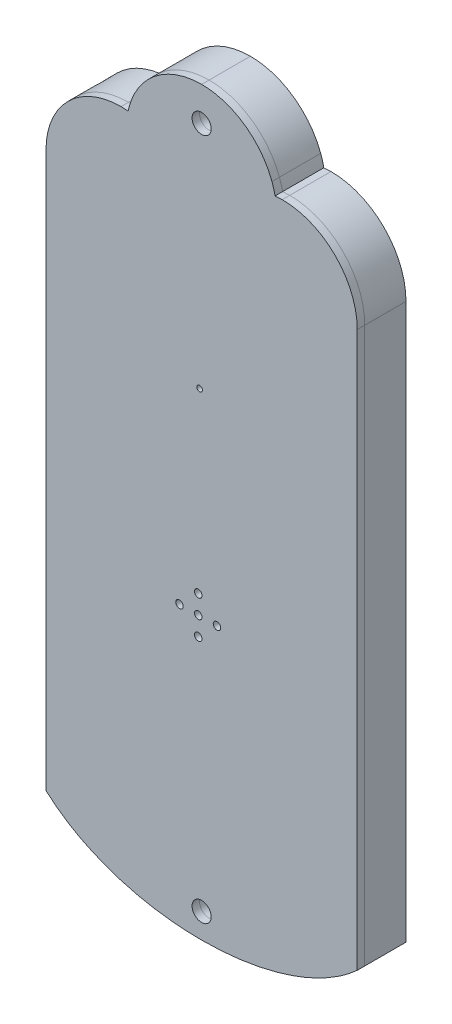
from build123d import *

# Parameters (mm, degrees)
SKETCH_1_R          = 2.55
EXTRUDE_1_DEPTH     = 11
CUT_EXTRUDE_1_DEPTH = 12
SKETCH_3_W          = 3.57346696
SKETCH_3_H          = 6.992054996
EXTRUDE_2_DEPTH     = 9
EXTRUDE_2_2_DEPTH   = 9
SKETCH_3_H_2        = 8.312138205
EXTRUDE_2_3_DEPTH   = 9
SKETCH_3_H_3        = 12.586021109
EXTRUDE_2_4_DEPTH   = 9
EXTRUDE_2_5_DEPTH   = 9
EXTRUDE_2_6_DEPTH   = 9
SKETCH_3_3_W        = 3.57346696
SKETCH_3_3_H        = 19.695806799
SKETCH_3_3_H_2      = 31.259766677
SKETCH_3_3_H_3      = 29.757407966
SKETCH_3_3_H_4      = 25.595250748
SKETCH_3_3_H_5      = 20
EXTRUDE_3_DEPTH     = 2
EXTRUDE_4_DEPTH     = 2
EXTRUDE_4_2_DEPTH   = 2
SKETCH_3_5_R        = 22
SKETCH_3_5_R_2      = 20
EXTRUDE_5_DEPTH     = 5
SKETCH_3_6_W        = 3.57346696
SKETCH_3_6_H        = 18.699822207
EXTRUDE_6_DEPTH     = 8.5
SKETCH_3_6_H_2      = 18.12494327
EXTRUDE_6_2_DEPTH   = 8.5
SKETCH_3_6_H_3      = 9.445483778
EXTRUDE_6_3_DEPTH   = 8.5
SKETCH_3_6_H_4      = 6.980918364
EXTRUDE_6_4_DEPTH   = 8.5
SKETCH_3_6_H_5      = 7.401231098
EXTRUDE_6_5_DEPTH   = 8.5
SKETCH_3_7_W        = 3.57346696
SKETCH_3_7_H        = 19.029379681
EXTRUDE_7_DEPTH     = 2
SKETCH_3_7_H_2      = 19.142987079
EXTRUDE_7_2_DEPTH   = 2
SKETCH_3_7_H_3      = 25.175234523
EXTRUDE_7_3_DEPTH   = 2
SKETCH_5_R          = 2.55
SKETCH_5_R_2        = 0.75
SKETCH_5_R_3        = 1
EXTRUDE_8_DEPTH     = 2
SKETCH_5_4_W        = 8.848247072
SKETCH_5_4_H        = 2.143421059
EXTRUDE_9_DEPTH     = 9
EXTRUDE_9_2_DEPTH   = 9
SKETCH_5_4_W_2      = 1.816180615
SKETCH_5_4_H_2      = 5.029639524
EXTRUDE_9_3_DEPTH   = 9
SKETCH_5_5_W        = 8.848247072
SKETCH_5_5_H        = 2.382179266
EXTRUDE_10_DEPTH    = 7
SKETCH_5_5_W_2      = 4.568018048
SKETCH_5_5_H_2      = 3
EXTRUDE_10_2_DEPTH  = 7
SKETCH_5_6_W        = 2.735670627
SKETCH_5_6_H        = 5.029639524
EXTRUDE_11_DEPTH    = 6


with BuildPart() as part:
    # 草图1 → 凸台-拉伸1 (new body)
    with BuildSketch(Plane.XY):
        with BuildLine():
            Line((-41.500782935, 68.140791219), (-41.500782935, -79.859208781))
            add(Edge.make_bspline(
                [(-41.500782935, -79.859208781), (-38.389280352, -82.702596808), (-34.568690991, -85.207331949), (-30.197769157, -87.278135781)],
                knots=[11, 11, 11, 11, 12, 12, 12, 12], degree=3))
            add(Edge.make_bspline(
                [(-30.197769157, -87.278135781), (-21.780496549, -91.268051585), (-11.324158051, -93.62813578), (0, -93.62813578)],
                knots=[12, 12, 12, 12, 13, 13, 13, 13], degree=3))
            add(Edge.make_bspline(
                [(0, -93.62813578), (11.324158051, -93.62813578), (21.780496549, -91.268051585), (30.197769157, -87.278135781)],
                knots=[13, 13, 13, 13, 14, 14, 14, 14], degree=3))
            add(Edge.make_bspline(
                [(30.197769157, -87.278135781), (34.568690991, -85.207331949), (38.389280352, -82.702596808), (41.500782935, -79.859208781)],
                knots=[14, 14, 14, 14, 15, 15, 15, 15], degree=3))
            Line((41.500782935, -79.859208781), (41.500782935, 68.140791219))
            add(Edge.make_bspline(
                [(41.500782935, 68.140791219), (41.500782935, 79.186262577), (32.547281215, 88.139764297), (21.501809857, 88.139764297)],
                knots=[0, 0, 0, 0, 1, 1, 1, 1], degree=3))
            add(Edge.make_bspline(
                [(21.501809857, 88.139764297), (20.859751717, 88.139764297), (20.221224801, 88.108026355), (19.593270021, 88.04803863)],
                knots=[1, 1, 1, 1, 2, 2, 2, 2], degree=3))
            add(Edge.make_bspline(
                [(19.593270021, 88.04803863), (19.388674413, 89.04640577), (19.106434966, 90.020075881), (18.760719634, 90.961986519)],
                knots=[2, 2, 2, 2, 3, 3, 3, 3], degree=3))
            add(Edge.make_bspline(
                [(18.760719634, 90.961986519), (15.938497412, 98.581999436), (8.604255165, 104.014764294), (0, 104.014764294)],
                knots=[3, 3, 3, 3, 4, 4, 4, 4], degree=3))
            add(Edge.make_bspline(
                [(0, 104.014764294), (-8.604255165, 104.014764294), (-15.938497412, 98.581999436), (-18.760719634, 90.961986519)],
                knots=[4, 4, 4, 4, 5, 5, 5, 5], degree=3))
            add(Edge.make_bspline(
                [(-18.760719634, 90.961986519), (-19.106456498, 90.020075881), (-19.388674413, 89.04640577), (-19.593270021, 88.04803863)],
                knots=[5, 5, 5, 5, 6, 6, 6, 6], degree=3))
            add(Edge.make_bspline(
                [(-19.593270021, 88.04803863), (-20.221224801, 88.108026355), (-20.856220494, 88.139764297), (-21.498278634, 88.139764297)],
                knots=[6, 6, 6, 6, 7, 7, 7, 7], degree=3))
            add(Edge.make_bspline(
                [(-21.498278634, 88.139764297), (-32.547281215, 88.139764297), (-41.500782935, 79.186262577), (-41.500782935, 68.140791219)],
                knots=[7, 7, 7, 7, 8, 8, 8, 8], degree=3))
        make_face()
        with Locations((0, 95)):
            Circle(SKETCH_1_R, mode=Mode.SUBTRACT)
        with Locations((0, -87)):
            Circle(SKETCH_1_R, mode=Mode.SUBTRACT)
    extrude(amount=EXTRUDE_1_DEPTH)

    # 草图2 → 切除-拉伸1 (cut)
    with BuildSketch(Plane.XY.offset(11)):
        with BuildLine():
            Line((-39, 72.56175603), (-31.85306608, 72.56175603))
            add(Edge.make_bspline(
                [(31.85306608, 72.56175603), (31.85306608, 88.82119273), (0, 88.82119273), (-31.85306608, 88.82119273), (-31.85306608, 72.56175603)],
                knots=[0, 0, 0, 1.570796327, 1.570796327, 3.141592654, 3.141592654, 3.141592654], degree=2, weights=[1, 0.707106781, 1, 0.707106781, 1]))
            Line((31.85306608, 72.56175603), (39, 72.56175603))
            Line((39, 72.56175603), (39, -79.43824397))
            Line((39, -79.43824397), (33.590068299, -79.43824397))
            ThreePointArc((33.590068299, -79.43824397), (33.058093845, -79.485786827), (32.542980448, -79.626908516))
            Line((32.542980448, -79.626908516), (5.947078237, -89.532608684))
            Line((5.947078237, -89.532608684), (5.947078237, -84.669920089))
            ThreePointArc((5.947078237, -84.669920089), (5.06839858, -82.548599745), (2.947078237, -81.669920089))
            Line((2.947078237, -81.669920089), (-3.919139465, -81.669920089))
            ThreePointArc((-3.919139465, -81.669920089), (-6.040459809, -82.548599745), (-6.919139465, -84.669920089))
            Line((-6.919139465, -84.669920089), (-6.919139465, -88.936950457))
            Line((-6.919139465, -88.936950457), (-32.753744515, -79.616285846))
            ThreePointArc((-32.753744515, -79.616285846), (-33.255075458, -79.483089628), (-33.771856663, -79.43824397))
            Line((-33.771856663, -79.43824397), (-39, -79.43824397))
            Line((-39, -79.43824397), (-39, 72.56175603))
        make_face()
    extrude(amount=-CUT_EXTRUDE_1_DEPTH, mode=Mode.SUBTRACT)


with BuildPart() as body_2:
    # 草图3 → 凸台-拉伸2 (new body)
    with BuildSketch(Plane.XY.offset(11)):
        with Locations((37.21326652, 69.065728532)):
            Rectangle(SKETCH_3_W, SKETCH_3_H)
    extrude(amount=-EXTRUDE_2_DEPTH)


with BuildPart() as body_3:
    # 草图3 → Extrude 2 2 (new body)
    with BuildSketch(Plane.XY.offset(11)):
        with Locations((-37.21326652, 69.065728532)):
            Rectangle(SKETCH_3_W, SKETCH_3_H)
    extrude(amount=-EXTRUDE_2_2_DEPTH)


with BuildPart() as body_4:
    # 草图3 → Extrude 2 3 (new body)
    with BuildSketch(Plane.XY.offset(11)):
        with Locations((-37.21326652, 41.717825133)):
            Rectangle(SKETCH_3_W, SKETCH_3_H_2)
    extrude(amount=-EXTRUDE_2_3_DEPTH)


with BuildPart() as body_5:
    # 草图3 → Extrude 2 4 (new body)
    with BuildSketch(Plane.XY.offset(11)):
        with Locations((37.21326652, 28.016923803)):
            Rectangle(SKETCH_3_W, SKETCH_3_H_3)
    extrude(amount=-EXTRUDE_2_4_DEPTH)


with BuildPart() as body_6:
    # 草图3 → Extrude 2 5 (new body)
    with BuildSketch(Plane.XY.offset(11)):
        Polygon((35.42653304, -14.104654672), (35.42653304, -17.43824397), (39, -17.43824397), (39, -8.033494718), (35.42653304, -8.033494718), align=None)
    extrude(amount=-EXTRUDE_2_5_DEPTH)


with BuildPart() as body_7:
    # 草图3 → Extrude 2 6 (new body)
    with BuildSketch(Plane.XY.offset(11)):
        Polygon((-35.42653304, -17.43824397), (-35.42653304, -14.104654672), (-35.42653304, -8.033494718), (-39, -8.033494718), (-39, -17.43824397), align=None)
    extrude(amount=-EXTRUDE_2_6_DEPTH)


with BuildPart() as body_8:
    # 草图3<3> → 凸台-拉伸3 (new body)
    with BuildSketch(Plane.XY.offset(11)):
        with Locations((-37.21326652, 55.721797635)):
            Rectangle(SKETCH_3_3_W, SKETCH_3_3_H)
        with Locations((37.21326652, 49.939817696)):
            Rectangle(SKETCH_3_3_W, SKETCH_3_3_H_2)
        with Locations((37.21326652, 6.845209265)):
            Rectangle(SKETCH_3_3_W, SKETCH_3_3_H_3)
        with Locations((-37.21326652, 4.764130656)):
            Rectangle(SKETCH_3_3_W, SKETCH_3_3_H_4)
        with Locations((-37.21326652, 27.56175603)):
            Rectangle(SKETCH_3_3_W, SKETCH_3_3_H_5)
    extrude(amount=-EXTRUDE_3_DEPTH)


with BuildPart() as body_9:
    # 草图3<4> → 凸台-拉伸4 (new body)
    with BuildSketch(Plane.XY.offset(11)):
        with BuildLine():
            Line((35.42653304, -21.183340916), (35.42653304, -17.43824397))
            Line((35.42653304, -17.43824397), (35.42653304, -14.104654672))
            Line((35.42653304, -14.104654672), (32.827882873, -14.104654672))
            Line((32.827882873, -14.104654672), (20.541921245, -14.104654672))
            ThreePointArc((20.541921245, -14.104654672), (20.957005378, -16.542142572), (21.09595179, -19.010813469))
            ThreePointArc((21.09595179, -19.010813469), (21.069052169, -20.098407004), (20.98841909, -21.183340916))
            Line((20.98841909, -21.183340916), (32.92605448, -21.183340916))
            Line((32.92605448, -21.183340916), (35.42653304, -21.183340916))
        make_face()
    extrude(amount=-EXTRUDE_4_DEPTH)


with BuildPart() as body_10:
    # 草图3<4> → Extrude 4 2 (new body)
    with BuildSketch(Plane.XY.offset(11)):
        with BuildLine():
            ThreePointArc((-22.796515511, -21.183340916), (-22.860413457, -17.625885611), (-22.350017665, -14.104654672))
            Line((-22.350017665, -14.104654672), (-30.878249286, -14.104654672))
            Line((-30.878249286, -14.104654672), (-35.42653304, -14.104654672))
            Line((-35.42653304, -14.104654672), (-35.42653304, -17.43824397))
            Line((-35.42653304, -17.43824397), (-35.42653304, -21.183340916))
            Line((-35.42653304, -21.183340916), (-30.78007768, -21.183340916))
            Line((-30.78007768, -21.183340916), (-22.796515511, -21.183340916))
        make_face()
    extrude(amount=-EXTRUDE_4_2_DEPTH)

    # 草图3<5> → 凸台-拉伸5 (add)
    with BuildSketch(Plane.XY.offset(11)):
        with Locations((-0.90404821, -19.010813469)):
            Circle(SKETCH_3_5_R)
        with Locations((-0.90404821, -19.010813469)):
            Circle(SKETCH_3_5_R_2, mode=Mode.SUBTRACT)
    extrude(amount=-EXTRUDE_5_DEPTH)


with BuildPart() as body_11:
    # 草图3<6> → 凸台-拉伸6 (new body)
    with BuildSketch(Plane.XY.offset(11)):
        with Locations((37.21326652, -26.788155074)):
            Rectangle(SKETCH_3_6_W, SKETCH_3_6_H)
    extrude(amount=-EXTRUDE_6_DEPTH)


with BuildPart() as body_12:
    # 草图3<6> → Extrude 6 2 (new body)
    with BuildSketch(Plane.XY.offset(11)):
        with Locations((37.21326652, -70.375772335)):
            Rectangle(SKETCH_3_6_W, SKETCH_3_6_H_2)
    extrude(amount=-EXTRUDE_6_2_DEPTH)


with BuildPart() as body_13:
    # 草图3<6> → Extrude 6 3 (new body)
    with BuildSketch(Plane.XY.offset(11)):
        with Locations((-37.21326652, -22.160985859)):
            Rectangle(SKETCH_3_6_W, SKETCH_3_6_H_3)
    extrude(amount=-EXTRUDE_6_3_DEPTH)


with BuildPart() as body_14:
    # 草图3<6> → Extrude 6 4 (new body)
    with BuildSketch(Plane.XY.offset(11)):
        with Locations((-37.21326652, -49.403566611)):
            Rectangle(SKETCH_3_6_W, SKETCH_3_6_H_4)
    extrude(amount=-EXTRUDE_6_4_DEPTH)


with BuildPart() as body_15:
    # 草图3<6> → Extrude 6 5 (new body)
    with BuildSketch(Plane.XY.offset(11)):
        with Locations((-37.21326652, -75.737628421)):
            Rectangle(SKETCH_3_6_W, SKETCH_3_6_H_5)
    extrude(amount=-EXTRUDE_6_5_DEPTH)


with BuildPart() as body_16:
    # 草图3<7> → 凸台-拉伸7 (new body)
    with BuildSketch(Plane.XY.offset(11)):
        with Locations((-37.21326652, -36.398417589)):
            Rectangle(SKETCH_3_7_W, SKETCH_3_7_H)
    extrude(amount=-EXTRUDE_7_DEPTH)


with BuildPart() as body_17:
    # 草图3<7> → Extrude 7 2 (new body)
    with BuildSketch(Plane.XY.offset(11)):
        with Locations((-37.21326652, -62.465519333)):
            Rectangle(SKETCH_3_7_W, SKETCH_3_7_H_2)
    extrude(amount=-EXTRUDE_7_2_DEPTH)


with BuildPart() as body_18:
    # 草图3<7> → Extrude 7 3 (new body)
    with BuildSketch(Plane.XY.offset(11)):
        with Locations((37.21326652, -48.725683438)):
            Rectangle(SKETCH_3_7_W, SKETCH_3_7_H_3)
    extrude(amount=-EXTRUDE_7_3_DEPTH)


with BuildPart() as body_19:
    # 草图5 → 凸台-拉伸8 (new body)
    with BuildSketch(Plane.XY.offset(11)):
        with BuildLine():
            Line((-41.500782935, 68.140791219), (-41.500782935, -79.859208781))
            add(Edge.make_bspline(
                [(-41.500782935, -79.859208781), (-38.389280352, -82.702596808), (-34.568690991, -85.207331949), (-30.197769157, -87.278135781)],
                knots=[11, 11, 11, 11, 12, 12, 12, 12], degree=3))
            add(Edge.make_bspline(
                [(-30.197769157, -87.278135781), (-21.780496549, -91.268051585), (-11.324158051, -93.62813578), (0, -93.62813578)],
                knots=[12, 12, 12, 12, 13, 13, 13, 13], degree=3))
            add(Edge.make_bspline(
                [(0, -93.62813578), (11.324158051, -93.62813578), (21.780496549, -91.268051585), (30.197769157, -87.278135781)],
                knots=[13, 13, 13, 13, 14, 14, 14, 14], degree=3))
            add(Edge.make_bspline(
                [(30.197769157, -87.278135781), (34.568690991, -85.207331949), (38.389280352, -82.702596808), (41.500782935, -79.859208781)],
                knots=[14, 14, 14, 14, 15, 15, 15, 15], degree=3))
            Line((41.500782935, -79.859208781), (41.500782935, 68.140791219))
            add(Edge.make_bspline(
                [(41.500782935, 68.140791219), (41.500782935, 79.186262577), (32.547281215, 88.139764297), (21.501809857, 88.139764297)],
                knots=[0, 0, 0, 0, 1, 1, 1, 1], degree=3))
            add(Edge.make_bspline(
                [(21.501809857, 88.139764297), (20.859751717, 88.139764297), (20.221224801, 88.108026355), (19.593270021, 88.04803863)],
                knots=[1, 1, 1, 1, 2, 2, 2, 2], degree=3))
            add(Edge.make_bspline(
                [(19.593270021, 88.04803863), (19.388674413, 89.04640577), (19.106434966, 90.020075881), (18.760719634, 90.961986519)],
                knots=[2, 2, 2, 2, 3, 3, 3, 3], degree=3))
            add(Edge.make_bspline(
                [(18.760719634, 90.961986519), (15.938497412, 98.581999436), (8.604255165, 104.014764294), (0, 104.014764294)],
                knots=[3, 3, 3, 3, 4, 4, 4, 4], degree=3))
            add(Edge.make_bspline(
                [(0, 104.014764294), (-8.604255165, 104.014764294), (-15.938497412, 98.581999436), (-18.760719634, 90.961986519)],
                knots=[4, 4, 4, 4, 5, 5, 5, 5], degree=3))
            add(Edge.make_bspline(
                [(-18.760719634, 90.961986519), (-19.106456498, 90.020075881), (-19.388674413, 89.04640577), (-19.593270021, 88.04803863)],
                knots=[5, 5, 5, 5, 6, 6, 6, 6], degree=3))
            add(Edge.make_bspline(
                [(-19.593270021, 88.04803863), (-20.221224801, 88.108026355), (-20.856220494, 88.139764297), (-21.498278634, 88.139764297)],
                knots=[6, 6, 6, 6, 7, 7, 7, 7], degree=3))
            add(Edge.make_bspline(
                [(-21.498278634, 88.139764297), (-32.547281215, 88.139764297), (-41.500782935, 79.186262577), (-41.500782935, 68.140791219)],
                knots=[7, 7, 7, 7, 8, 8, 8, 8], degree=3))
        make_face()
        with Locations((0, 95)):
            Circle(SKETCH_5_R, mode=Mode.SUBTRACT)
        with Locations((0, -87)):
            Circle(SKETCH_5_R, mode=Mode.SUBTRACT)
        with Locations((-0.543837801, 33.493429894)):
            Circle(SKETCH_5_R_2, mode=Mode.SUBTRACT)
        with Locations((-0.90404821, -19.010813469)):
            Circle(SKETCH_5_R_3, mode=Mode.SUBTRACT)
        with Locations((-0.90404821, -14.010813469)):
            Circle(SKETCH_5_R_3, mode=Mode.SUBTRACT)
        with Locations((4.09595179, -19.010813469)):
            Circle(SKETCH_5_R_3, mode=Mode.SUBTRACT)
        with Locations((-0.90404821, -24.010813469)):
            Circle(SKETCH_5_R_3, mode=Mode.SUBTRACT)
        with Locations((-5.90404821, -19.010813469)):
            Circle(SKETCH_5_R_3, mode=Mode.SUBTRACT)
    extrude(amount=EXTRUDE_8_DEPTH)


with BuildPart() as body_20:
    # 草图5<4> → 凸台-拉伸9 (new body)
    with BuildSketch(Plane.XY.offset(11)):
        with Locations((31.002409504, 47.63346656)):
            Rectangle(SKETCH_5_4_W, SKETCH_5_4_H)
    extrude(amount=-EXTRUDE_9_DEPTH)


with BuildPart() as body_21:
    # 草图5<4> → Extrude 9 2 (new body)
    with BuildSketch(Plane.XY.offset(11)):
        Polygon((-5.537972227, 6.089696412), (-5.537972227, 4.647534595), (-11.92217089, 4.647534595), (-11.92217089, 14.766706626), (-10.105990275, 14.766706626), (-10.105990275, 6.089696412), align=None)
    extrude(amount=-EXTRUDE_9_2_DEPTH)


with BuildPart() as body_22:
    # 草图5<4> → Extrude 9 3 (new body)
    with BuildSketch(Plane.XY.offset(11)):
        with Locations((-11.014080583, 39.338697772)):
            Rectangle(SKETCH_5_4_W_2, SKETCH_5_4_H_2)
    extrude(amount=-EXTRUDE_9_3_DEPTH)


with BuildPart() as body_23:
    # 草图5<5> → 凸台-拉伸10 (new body)
    with BuildSketch(Plane.XY.offset(11)):
        with Locations((31.002409504, 45.370666397)):
            Rectangle(SKETCH_5_5_W, SKETCH_5_5_H)
    extrude(amount=-EXTRUDE_10_DEPTH)


with BuildPart() as body_24:
    # 草图5<5> → Extrude 10 2 (new body)
    with BuildSketch(Plane.XY.offset(11)):
        with Locations((-7.821981251, 7.589696412)):
            Rectangle(SKETCH_5_5_W_2, SKETCH_5_5_H_2)
    extrude(amount=-EXTRUDE_10_2_DEPTH)


with BuildPart() as body_25:
    # 草图5<6> → 凸台-拉伸11 (new body)
    with BuildSketch(Plane.XY.offset(11)):
        with Locations((-8.738154962, 39.338697772)):
            Rectangle(SKETCH_5_6_W, SKETCH_5_6_H)
    extrude(amount=-EXTRUDE_11_DEPTH)


solid = Compound([part.part, body_2.part, body_3.part, body_4.part, body_5.part, body_6.part, body_7.part, body_8.part, body_9.part, body_10.part, body_11.part, body_12.part, body_13.part, body_14.part, body_15.part, body_16.part, body_17.part, body_18.part, body_19.part, body_20.part, body_21.part, body_22.part, body_23.part, body_24.part, body_25.part])
